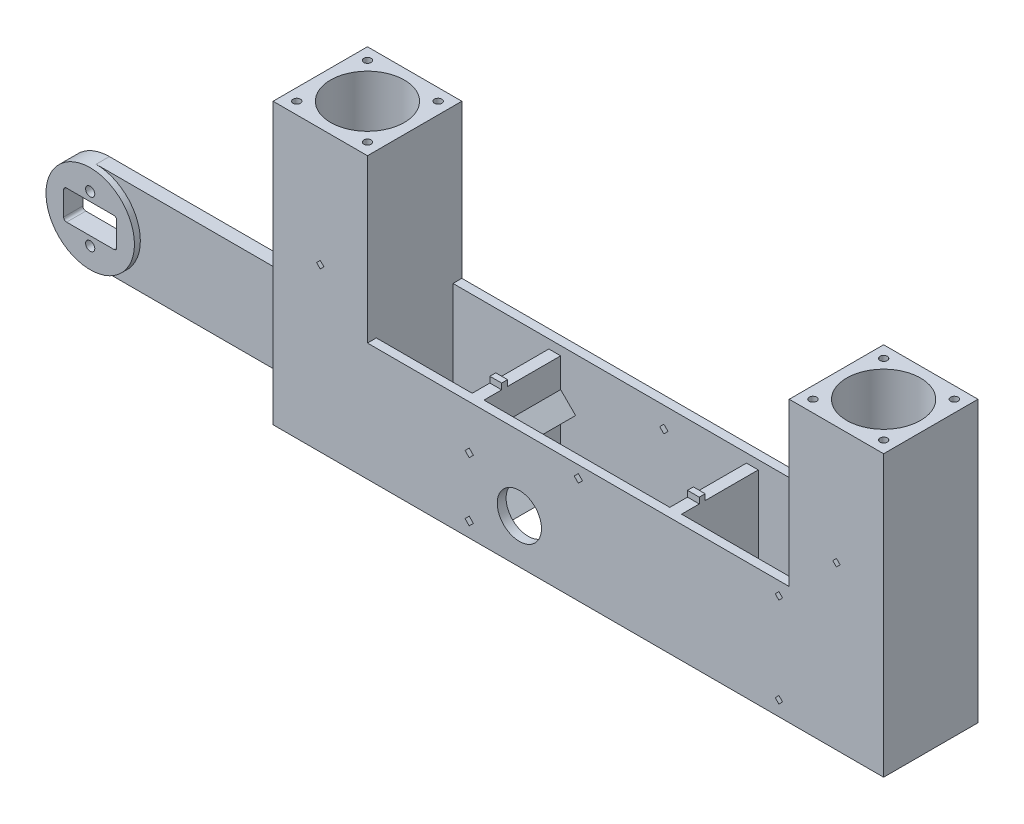
from build123d import *

# Parameters (mm, degrees)
AUFSATZ_LINEAR_AUSTRAGEN1_DEPTH      = 80
AUFSATZ_LINEAR_AUSTRAGEN1_DEPTH_BACK = 15
SKIZZE1_W                            = 207
SKIZZE1_H                            = 32
SKIZZE1_R                            = 9.5
SKIZZE2_R                            = 12.5
SCHNITT_LINEAR_AUSTRAGEN1_DEPTH      = 31
SCHNITT_LINEAR_START                 = -31
SKIZZE3_R                            = 12.5
SCHNITT_LINEAR_AUSTRAGEN2_DEPTH      = 31
SCHNITT_LINEAR_AUSTRAGEN3_DEPTH      = 132.788656568
SCHNITT_LINEAR_AUSTRAGEN3_DEPTH_BACK = 5
SKIZZE4_R                            = 7.5
SKIZZE6_W                            = 143
SKIZZE6_H                            = 55
SCHNITT_LINEAR_AUSTRAGEN5_DEPTH      = 135.670895148
AUFSATZ_LINEAR_AUSTRAGEN2_DEPTH      = 5
AUFSATZ_LINEAR_AUSTRAGEN2_DEPTH_BACK = 1.5
SKIZZE5_R                            = 1.55
SCHNITT_LINEAR_AUSTRAGEN6_DEPTH      = 204.238775828
SCHNITT_LINEAR_AUSTRAGEN6_DEPTH_BACK = 204.238775828
SKIZZE8_W                            = 99.5
SKIZZE8_H                            = 26
SKIZZE8_W_2                          = 39.5
F_2_5_2_5_DURCHMESSER_BOHRUNG2_D     = 2.5
F_2_5_2_5_DURCHMESSER_BOHRUNG2_DEPTH = 10
F_2_5_2_5_DURCHMESSER_BOHRUNG2_TIP   = 1.25
F_2_5_2_5_DURCHMESSER_BOHRUNG1_D     = 2.5
F_2_5_2_5_DURCHMESSER_BOHRUNG1_DEPTH = 10
F_2_5_2_5_DURCHMESSER_BOHRUNG1_TIP   = 1.25
SCHNITT_LINEAR_AUSTRAGEN7_DEPTH      = 2
AUFSATZ_LINEAR_AUSTRAGEN3_DEPTH      = 67.5
SCHNITT_LINEAR_AUSTRAGEN8_DEPTH      = 12
AUFSATZ_LINEAR_AUSTRAGEN4_DEPTH      = 29
SCHNITT_LINEAR_AUSTRAGEN9_DEPTH      = 26
VERRUNDUNG1_R                        = 10
SKIZZE20_W                           = 143
SKIZZE20_H                           = 3
AUFSATZ_LINEAR_AUSTRAGEN5_DEPTH      = 3
SCHNITT_LINEAR_AUSTRAGEN10_DEPTH     = 214.187710715
SCHNITT_LINEAR_AUSTRAGEN11_DEPTH     = 212.378806885
VERRUNDUNG2_R                        = 2.5
SKIZZE23_W                           = 4
SKIZZE23_H                           = 2
AUFSATZ_LINEAR_AUSTRAGEN6_DEPTH      = 2


with BuildPart() as part:
    # Skizze1 → Aufsatz-Linear austragen1 (new, two sides: drawn at the far end of the back side and taken through both)
    with BuildSketch(Plane(origin=(0, 0, 0), x_dir=(1, 0, 0), z_dir=(0, 1, 0)).offset(-AUFSATZ_LINEAR_AUSTRAGEN1_DEPTH_BACK)):
        Rectangle(SKIZZE1_W, SKIZZE1_H)
        with Locations(Location((-87.5, 0, 0), (0, 0, 270))):
            Circle(SKIZZE1_R, mode=Mode.SUBTRACT)
        with Locations(Location((87.5, 0, 0), (0, 0, 90))):
            Circle(SKIZZE1_R, mode=Mode.SUBTRACT)
    extrude(amount=AUFSATZ_LINEAR_AUSTRAGEN1_DEPTH + AUFSATZ_LINEAR_AUSTRAGEN1_DEPTH_BACK)

    # Skizze2 → Schnitt-Linear austragen1 (cut)
    with BuildSketch(Plane(origin=(0, 80, 0), x_dir=(1, 0, 0), z_dir=(0, 1, 0))):
        with Locations(Location((-87.5, 0, 0), (0, 0, 270))):
            Circle(SKIZZE2_R)
        with Locations(Location((87.5, 0, 0), (0, 0, 270))):
            Circle(SKIZZE2_R)
    extrude(amount=-SCHNITT_LINEAR_AUSTRAGEN1_DEPTH, mode=Mode.SUBTRACT)

    # Skizze3 → Schnitt-Linear austragen2 (cut)
    with BuildSketch(Plane.XZ.offset(15).offset(SCHNITT_LINEAR_START)):
        with Locations(Location((-87.5, 0, 0), (0, 0, 90))):
            Circle(SKIZZE3_R)
        with Locations(Location((87.5, 0, 0), (0, 0, 90))):
            Circle(SKIZZE3_R)
    extrude(amount=SCHNITT_LINEAR_AUSTRAGEN2_DEPTH, mode=Mode.SUBTRACT)

    # Skizze4 → Schnitt-Linear austragen3 (cut, two sides: drawn at the far end of the back side and taken through both)
    with BuildSketch(Plane.XY.offset(-SCHNITT_LINEAR_AUSTRAGEN3_DEPTH_BACK)):
        with Locations((-20, 0)):
            Circle(SKIZZE4_R)
        Polygon((-38.414213562, 10), (-37, 11.414213562), (-35.585786438, 10), (-37, 8.585786438), align=None)
        Polygon((-35.585786438, -10), (-37, -8.585786438), (-38.414213562, -10), (-37, -11.414213562), align=None)
    extrude(amount=SCHNITT_LINEAR_AUSTRAGEN3_DEPTH + SCHNITT_LINEAR_AUSTRAGEN3_DEPTH_BACK, mode=Mode.SUBTRACT)

    # Skizze6 → Schnitt-Linear austragen5 (cut, through all)
    with BuildSketch(Plane.XY.offset(16)):
        with Locations((0, 52.5)):
            Rectangle(SKIZZE6_W, SKIZZE6_H)
    extrude(amount=-SCHNITT_LINEAR_AUSTRAGEN5_DEPTH, mode=Mode.SUBTRACT)

    # Skizze5 → Aufsatz-Linear austragen2 (add, two sides: drawn at the far end of the back side and taken through both)
    with BuildSketch(Plane(origin=(0, 0, 0), x_dir=(-1, 0, 0), z_dir=(0, 0, -1)).offset(-AUFSATZ_LINEAR_AUSTRAGEN2_DEPTH_BACK)):
        with BuildLine():
            Line((180, 15), (103.5, 15))
            Line((103.5, 15), (103.5, -15))
            Line((103.5, -15), (180, -15))
            ThreePointArc((180, -15), (195, 0), (180, 15))
        make_face()
        with Locations((180, 8)):
            Circle(SKIZZE5_R, mode=Mode.SUBTRACT)
        with Locations(Location((180, -8, 0), (0, 0, 180))):
            Circle(SKIZZE5_R, mode=Mode.SUBTRACT)
        with BuildLine():
            Line((171, -4), (171, 4))
            ThreePointArc((171, 4), (171.292893219, 4.707106781), (172, 5))
            Line((172, 5), (188, 5))
            ThreePointArc((188, 5), (188.707106781, 4.707106781), (189, 4))
            Line((189, 4), (189, -4))
            ThreePointArc((189, -4), (188.707106781, -4.707106781), (188, -5))
            Line((188, -5), (172, -5))
            ThreePointArc((172, -5), (171.292893219, -4.707106781), (171, -4))
        make_face(mode=Mode.SUBTRACT)
    extrude(amount=AUFSATZ_LINEAR_AUSTRAGEN2_DEPTH + AUFSATZ_LINEAR_AUSTRAGEN2_DEPTH_BACK)

    # Skizze8 → Schnitt-Linear austragen6 (cut, two sides: drawn at the far end of the back side and taken through both)
    with BuildSketch(Plane(origin=(0, 25, 0), x_dir=(1, 0, 0), z_dir=(0, 1, 0)).offset(-SCHNITT_LINEAR_AUSTRAGEN6_DEPTH_BACK)):
        with Locations((-21.75, 0)):
            Rectangle(SKIZZE8_W, SKIZZE8_H)
        with Locations((51.75, 0)):
            Rectangle(SKIZZE8_W_2, SKIZZE8_H)
    extrude(amount=SCHNITT_LINEAR_AUSTRAGEN6_DEPTH + SCHNITT_LINEAR_AUSTRAGEN6_DEPTH_BACK, mode=Mode.SUBTRACT)

    # Ø2.5 (2.5) Durchmesser Bohrung2
    with Locations(Plane(origin=(0, 80, 0), x_dir=(1, 0, 0), z_dir=(0, 1, 0))):
        with Locations((75.511004525, -11.988995475), (99.488995475, -11.988995475), (75.511004525, 11.988995475), (99.488995475, 11.988995475), (-75.511004525, 11.988995475), (-99.488995475, 11.988995475), (-75.511004525, -11.988995475), (-99.488995475, -11.988995475)):
            Hole(F_2_5_2_5_DURCHMESSER_BOHRUNG2_D / 2, depth=F_2_5_2_5_DURCHMESSER_BOHRUNG2_DEPTH)
            with Locations((0, 0, -(F_2_5_2_5_DURCHMESSER_BOHRUNG2_DEPTH + F_2_5_2_5_DURCHMESSER_BOHRUNG2_TIP / 2))):  # 90° drill point
                Cone(0, F_2_5_2_5_DURCHMESSER_BOHRUNG2_D / 2, F_2_5_2_5_DURCHMESSER_BOHRUNG2_TIP, mode=Mode.SUBTRACT)

    # Ø2.5 (2.5) Durchmesser Bohrung1
    with Locations(Plane(origin=(0, -15, 0), x_dir=(-1, 0, 0), z_dir=(0, -1, 0))):
        with Locations((-75.511004525, 11.988995475), (-99.488995475, 11.988995475), (-99.488995475, -11.988995475), (-75.511004525, -11.988995475), (75.511004525, 11.988995475), (99.488995475, 11.988995475), (75.511004525, -11.988995475), (99.488995475, -11.988995475)):
            Hole(F_2_5_2_5_DURCHMESSER_BOHRUNG1_D / 2, depth=F_2_5_2_5_DURCHMESSER_BOHRUNG1_DEPTH)
            with Locations((0, 0, -(F_2_5_2_5_DURCHMESSER_BOHRUNG1_DEPTH + F_2_5_2_5_DURCHMESSER_BOHRUNG1_TIP / 2))):  # 90° drill point
                Cone(0, F_2_5_2_5_DURCHMESSER_BOHRUNG1_D / 2, F_2_5_2_5_DURCHMESSER_BOHRUNG1_TIP, mode=Mode.SUBTRACT)

    # Skizze13 → Schnitt-Linear austragen7 (cut)
    with BuildSketch(Plane.XY.offset(1.5)):
        with BuildLine():
            Line((-180, 15), (-103.5, 15))
            Line((-103.5, 15), (-103.5, -15))
            Line((-103.5, -15), (-180, -15))
            ThreePointArc((-180, -15), (-165, 0), (-180, 15))
        make_face()
    extrude(amount=-SCHNITT_LINEAR_AUSTRAGEN7_DEPTH, mode=Mode.SUBTRACT)

    # Skizze14 → Aufsatz-Linear austragen3 (add)
    with BuildSketch(Plane.ZY.offset(103.5)):
        Polygon((-5, -15), (-13.5, -15), (-13.5, -7.221825407), (-5, 1.278174593), (-5, 1.222837222), align=None)
        with BuildLine():
            Line((-10.621320344, -7.878679656), (-8.5, -5.757359313))
            Line((-8.5, -5.757359313), (-6.378679656, -7.878679656))
            ThreePointArc((-6.378679656, -7.878679656), (-8.5, -13), (-10.621320344, -7.878679656))
        make_face(mode=Mode.SUBTRACT)
    extrude(amount=AUFSATZ_LINEAR_AUSTRAGEN3_DEPTH)

    # Skizze15 → Schnitt-Linear austragen8 (cut)
    with BuildSketch(Plane.XY.offset(16)):
        Polygon((66.75, 20.5), (68, 21.75), (69.25, 20.5), (68, 19.25), align=None)
        Polygon((68, -8.75), (69.25, -10), (68, -11.25), (66.75, -10), align=None)
    extrude(amount=-SCHNITT_LINEAR_AUSTRAGEN8_DEPTH, mode=Mode.SUBTRACT)

    # Skizze17 → Aufsatz-Linear austragen4 (add)
    with BuildSketch(Plane(origin=(0, 0, -16), x_dir=(-1, 0, 0), z_dir=(0, 0, -1))):
        Polygon((39, 25), (35, 25), (35, 15.071067812), (29.928932188, 10), (35, 4.928932188), (35, -4.928932188), (29.928932188, -10), (35, -15.071067812), (35, -15), (39, -15), (39, -15.071067812), (44.071067812, -10), (39, -4.928932188), (39, 4.928932188), (44.071067812, 10), (39, 15.071067812), align=None)
        Polygon((37, 11.414213562), (35.585786438, 10), (37, 8.585786438), (38.414213562, 10), align=None, mode=Mode.SUBTRACT)
        Polygon((37, -8.585786438), (38.414213562, -10), (37, -11.414213562), (35.585786438, -10), align=None, mode=Mode.SUBTRACT)
    extrude(amount=-AUFSATZ_LINEAR_AUSTRAGEN4_DEPTH)

    # Skizze18 → Schnitt-Linear austragen9 (cut)
    with BuildSketch(Plane(origin=(0, 0, -16), x_dir=(-1, 0, 0), z_dir=(0, 0, -1))):
        Polygon((32.898780669, 10), (37, 14.101219331), (41.101219331, 10), (37, 5.898780669), align=None)
        Polygon((32.898780669, -10), (37, -5.898780669), (41.101219331, -10), (37, -14.101219331), align=None)
    extrude(amount=-SCHNITT_LINEAR_AUSTRAGEN9_DEPTH, mode=Mode.SUBTRACT)

    # Verrundung1
    verrundung1_edges = [part.edges().sort_by_distance(p)[0] for p in [
        (-103.5, 15, -2.75),
        (-103.5, 0, -0.5),
    ]]
    fillet(verrundung1_edges, radius=VERRUNDUNG1_R)

    # Skizze20 → Aufsatz-Linear austragen5 (add)
    with BuildSketch(Plane(origin=(0, 25, 0), x_dir=(1, 0, 0), z_dir=(0, 1, 0))):
        with Locations((0, 14.5)):
            Rectangle(SKIZZE20_W, SKIZZE20_H)
    extrude(amount=AUFSATZ_LINEAR_AUSTRAGEN5_DEPTH)

    # Skizze21 → Schnitt-Linear austragen10 (cut, through all)
    with BuildSketch(Plane.XY.offset(16)):
        Polygon((0, 22.414213562), (-1.414213562, 21), (0, 19.585786438), (1.414213562, 21), align=None)
    extrude(amount=-SCHNITT_LINEAR_AUSTRAGEN10_DEPTH, mode=Mode.SUBTRACT)

    # Skizze22 → Schnitt-Linear austragen11 (cut, through all)
    with BuildSketch(Plane.XY):
        Polygon((-87.5, 41.25), (-88.75, 40), (-87.5, 38.75), (-86.25, 40), align=None)
        Polygon((87.5, 41.25), (86.25, 40), (87.5, 38.75), (88.75, 40), align=None)
    extrude(amount=SCHNITT_LINEAR_AUSTRAGEN11_DEPTH, mode=Mode.SUBTRACT)

    # Verrundung2
    verrundung2_edges = [part.edges().sort_by_distance(p)[0] for p in [
        (-37, 5.898780669, -3),
        (-37, -14.101219331, -3),
    ]]
    fillet(verrundung2_edges, radius=VERRUNDUNG2_R)

    # Skizze23 → Aufsatz-Linear austragen6 (add)
    with BuildSketch(Plane(origin=(0, 25, 0), x_dir=(1, 0, 0), z_dir=(0, 1, 0))):
        with Locations((-37, -6)):
            Rectangle(SKIZZE23_W, SKIZZE23_H)
        with Locations((30, -6)):
            Rectangle(SKIZZE23_W, SKIZZE23_H)
    extrude(amount=AUFSATZ_LINEAR_AUSTRAGEN6_DEPTH)


solid = part.part
